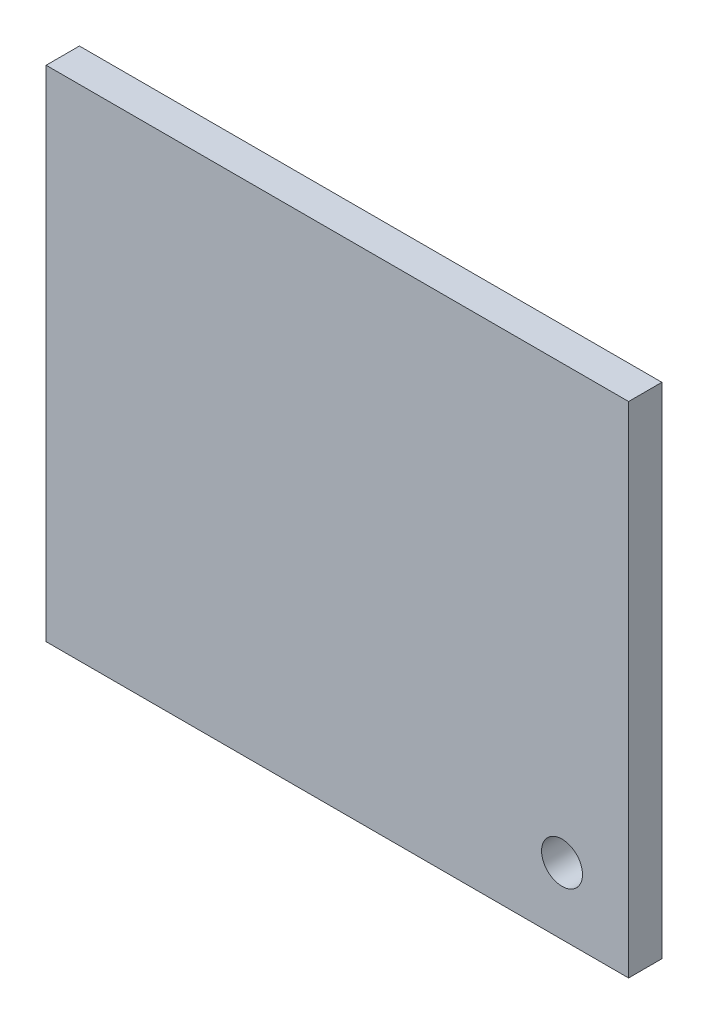
from build123d import *

# Parameters (mm, degrees)
SKETCH1_W           = 35
SKETCH1_H           = 30
BOSS_EXTRUDE1_DEPTH = 2
SKETCH2_R           = 1.23
CUT_EXTRUDE1_DEPTH  = 2


with BuildPart() as part:
    # Sketch1 → Boss-Extrude1 (new body)
    with BuildSketch(Plane.XY):
        Rectangle(SKETCH1_W, SKETCH1_H)
    extrude(amount=BOSS_EXTRUDE1_DEPTH)

    # Sketch2 → Cut-Extrude1 (cut)
    with BuildSketch(Plane.XY.offset(2)):
        with Locations((13.5, -11)):
            Circle(SKETCH2_R)
    extrude(amount=-CUT_EXTRUDE1_DEPTH, mode=Mode.SUBTRACT)


solid = part.part
